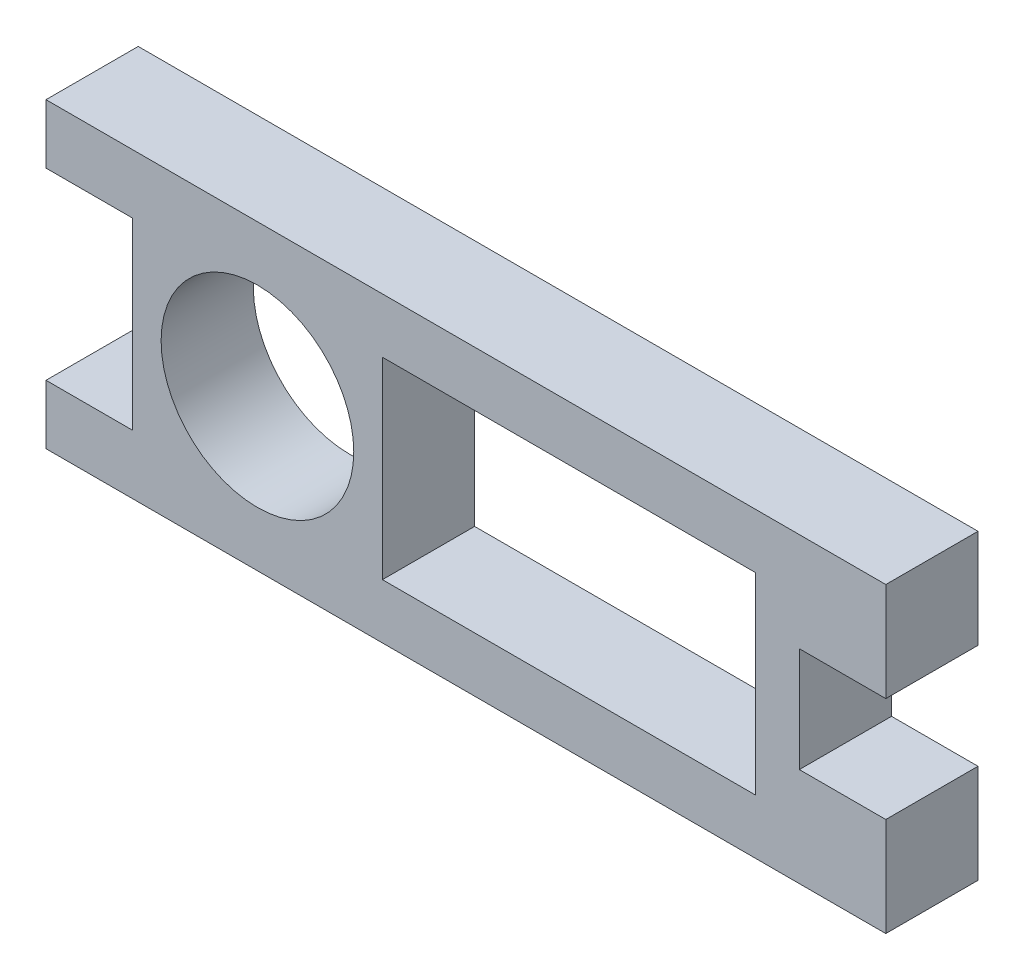
from build123d import *

# Parameters (mm, degrees)
SKETCH1_R           = 5.85
SKETCH1_W           = 22.669
SKETCH1_H           = 11.7
BOSS_EXTRUDE1_DEPTH = 5.6


with BuildPart() as part:
    # Sketch1 → Boss-Extrude1 (new body)
    with BuildSketch(Plane.XY):
        Polygon((702.290264671, 402.743983564), (702.290264671, 391.585983564), (697.040264671, 391.585983564), (697.040264671, 387.985983564), (748.040264671, 387.985983564), (748.040264671, 393.985983564), (742.790264671, 393.985983564), (742.790264671, 400.343983564), (748.040264671, 400.343983564), (748.040264671, 406.343983564), (697.040264671, 406.343983564), (697.040264671, 402.743983564), align=None)
        with Locations((709.880764671, 397.164983564)):
            Circle(SKETCH1_R, mode=Mode.SUBTRACT)
        with Locations((728.805764671, 397.164983564)):
            Rectangle(SKETCH1_W, SKETCH1_H, mode=Mode.SUBTRACT)
    extrude(amount=BOSS_EXTRUDE1_DEPTH)


solid = part.part
